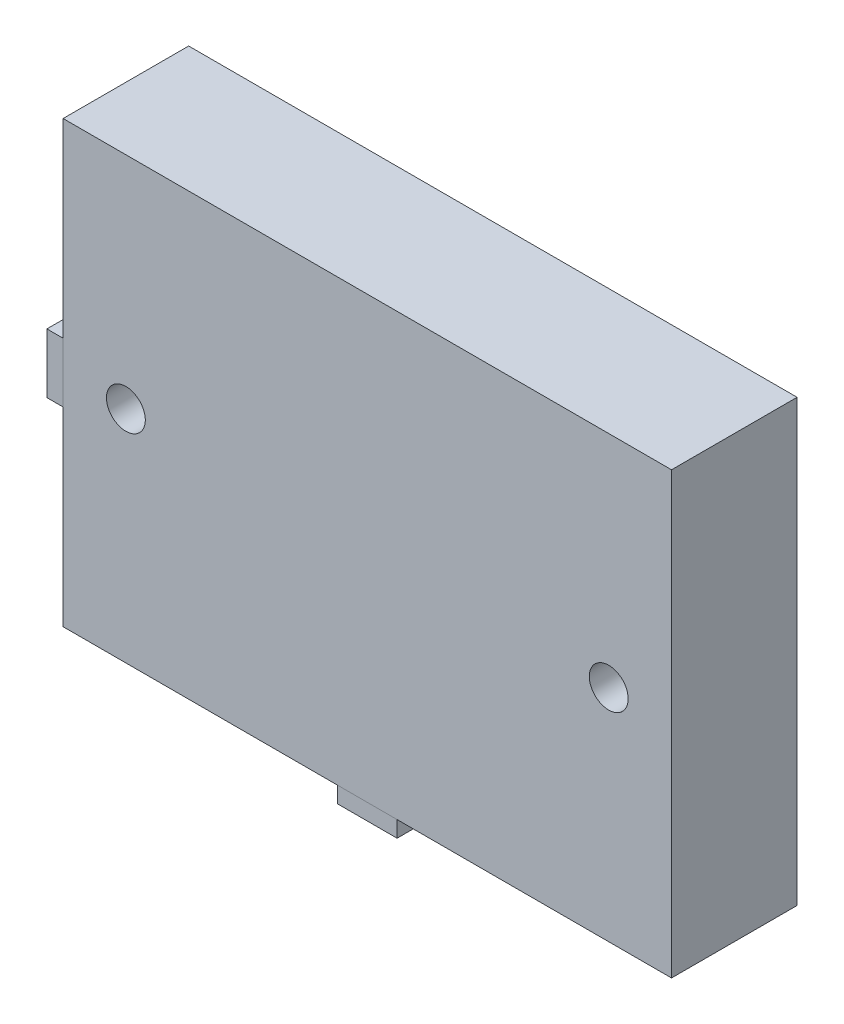
from build123d import *

# Parameters (mm, degrees)
ESQUISSE1_W             = 47
ESQUISSE1_H             = 34
BOSS_EXTRU_1_DEPTH      = 9.7
ESQUISSE2_W             = 1.25
ESQUISSE2_H             = 4.6
BOSS_EXTRU_2_DEPTH      = 9.7
ESQUISSE2_W_2           = 4.6
ESQUISSE2_H_2           = 1.25
BOSS_EXTRU_2_2_DEPTH    = 9.7
ESQUISSE3_R             = 1.5
ENL_V_MAT_EXTRU_1_DEPTH = 59.814028939


with BuildPart() as part:
    # Esquisse1 → Boss.-Extru.1 (new body)
    with BuildSketch(Plane.XY):
        with Locations((23.5, 17)):
            Rectangle(ESQUISSE1_W, ESQUISSE1_H)
    extrude(amount=BOSS_EXTRU_1_DEPTH)

    # Esquisse3 → Enlèv. mat.-Extru.1 (cut, through all)
    with BuildSketch(Plane.XY.offset(9.7)):
        with Locations((42.15, 17)):
            Circle(ESQUISSE3_R)
        with Locations(Location((4.85, 17, 0), (0, 0, 180))):
            Circle(ESQUISSE3_R)
    extrude(amount=-ENL_V_MAT_EXTRU_1_DEPTH, mode=Mode.SUBTRACT)


with BuildPart() as body_2:
    # Esquisse2 → Boss.-Extru.2 (new, through all)
    with BuildSketch(Plane.XY.offset(9.7)):
        with Locations((-0.625, 17)):
            Rectangle(ESQUISSE2_W, ESQUISSE2_H)
    extrude(amount=-BOSS_EXTRU_2_DEPTH)


with BuildPart() as body_3:
    # Esquisse2 → Boss.-Extru.2 2 (new, through all)
    with BuildSketch(Plane.XY.offset(9.7)):
        with Locations((23.5, -0.625)):
            Rectangle(ESQUISSE2_W_2, ESQUISSE2_H_2)
    extrude(amount=-BOSS_EXTRU_2_2_DEPTH)


solid = Compound([part.part, body_2.part, body_3.part])
